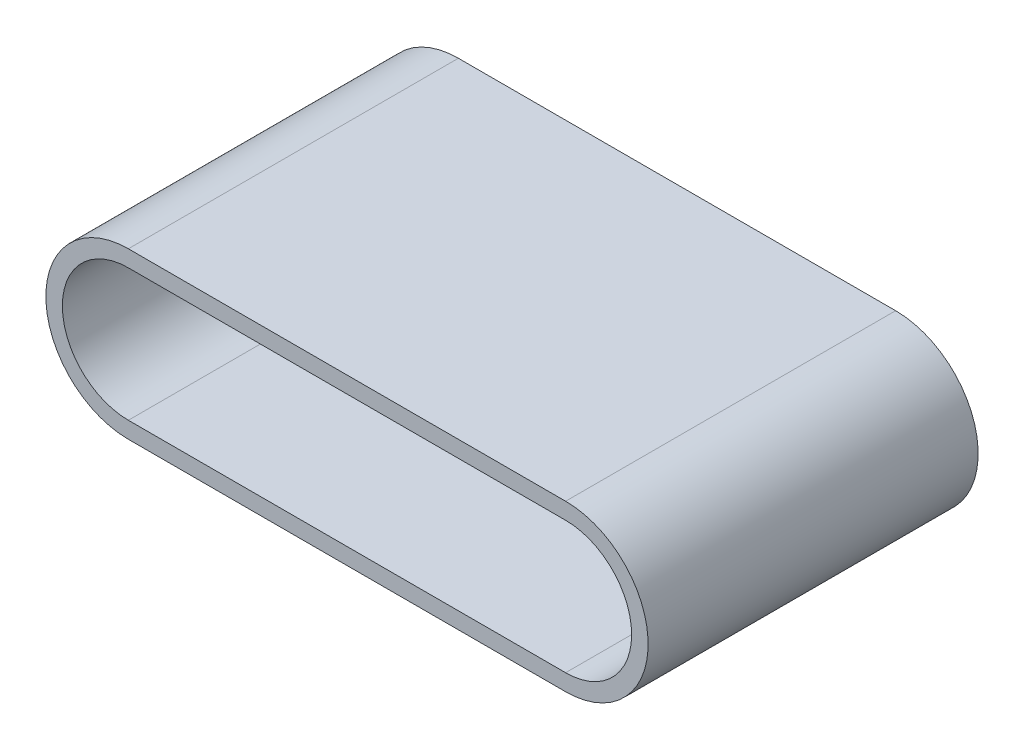
from build123d import *

# Parameters (mm, degrees)
EXTRUDE_1_DEPTH = 100


with BuildPart() as part:
    # 草图2 → 拉伸-薄壁1 (new, symmetric)
    with BuildSketch(Plane.XY):
        with BuildLine():
            Line((322.434199132, -50), (57.434199132, -50))
            ThreePointArc((57.434199132, -50), (7.434199132, 0), (57.434199132, 50))
            Line((57.434199132, 50), (322.434199132, 50))
            ThreePointArc((322.434199132, 50), (372.434199132, 0), (322.434199132, -50))
        make_face()
        with BuildLine():
            Line((322.434199132, -40), (57.434199132, -40))
            ThreePointArc((57.434199132, -40), (17.434199132, 0), (57.434199132, 40))
            Line((57.434199132, 40), (322.434199132, 40))
            ThreePointArc((322.434199132, 40), (362.434199132, 0), (322.434199132, -40))
        make_face(mode=Mode.SUBTRACT)
    extrude(amount=EXTRUDE_1_DEPTH, both=True)


solid = part.part
